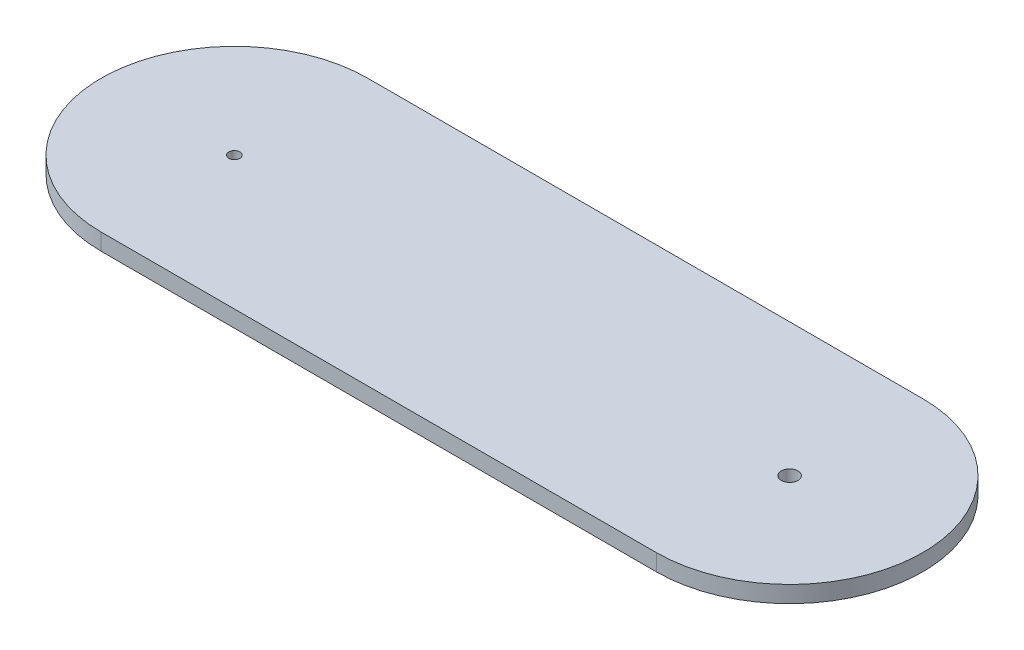
from build123d import *

# Parameters (mm, degrees)
BOSS_EXTRUDE1_DEPTH = 3
SKETCH2_R           = 1
CUT_EXTRUDE1_DEPTH  = 3
SKETCH4_R           = 1.5
CUT_EXTRUDE2_DEPTH  = 10


with BuildPart() as part:
    # Sketch1 → Boss-Extrude1 (new body)
    with BuildSketch(Plane(origin=(0, 0, 0), x_dir=(1, 0, 0), z_dir=(0, 1, 0))):
        with BuildLine():
            Line((0, 24), (100, 24))
            ThreePointArc((100, 24), (124, 0), (100, -24))
            Line((100, -24), (0, -24))
            ThreePointArc((0, -24), (-24, 0), (0, 24))
        make_face()
    extrude(amount=BOSS_EXTRUDE1_DEPTH)

    # Sketch2 → Cut-Extrude1 (cut)
    with BuildSketch(Plane(origin=(0, 3, 0), x_dir=(1, 0, 0), z_dir=(0, 1, 0))):
        with Locations(Location((0, 0, 0), (0, 0, 270))):
            Circle(SKETCH2_R)
    extrude(amount=-CUT_EXTRUDE1_DEPTH, mode=Mode.SUBTRACT)

    # Sketch4 → Cut-Extrude2 (cut)
    with BuildSketch(Plane(origin=(0, 3, 0), x_dir=(1, 0, 0), z_dir=(0, 1, 0))):
        with Locations(Location((100, 0, 0), (0, 0, 270))):
            Circle(SKETCH4_R)
    extrude(amount=-CUT_EXTRUDE2_DEPTH, mode=Mode.SUBTRACT)


solid = part.part
